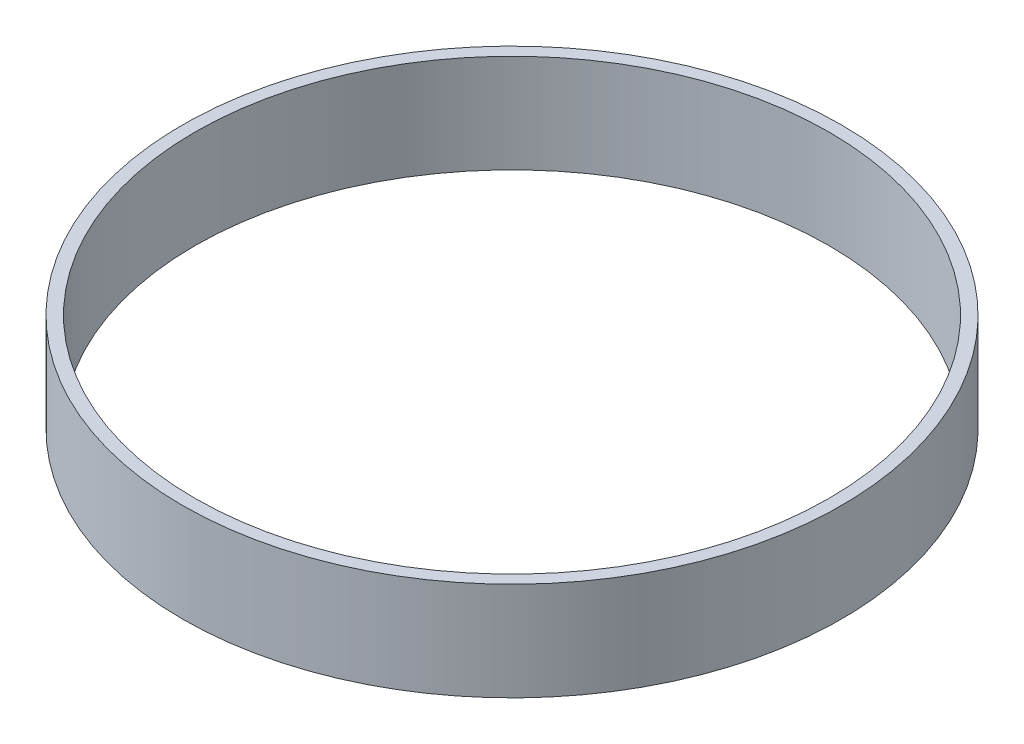
from build123d import *

# Parameters (mm, degrees)
SKETCH1_W = 3.586567335
SKETCH1_H = 28.448


with BuildPart() as part:
    # Sketch1 → Revolve1 (revolve)
    with BuildSketch(Plane.XY, mode=Mode.PRIVATE) as revolve1_sk:
        with Locations((93.456716333, 14.224)):
            Rectangle(SKETCH1_W, SKETCH1_H)
    revolve(revolve1_sk.sketch.rotate(Axis((0, 0, 0), (0, 1, 0)), 90), axis=Axis((0, 0, 0), (0, 1, 0)))


solid = part.part
